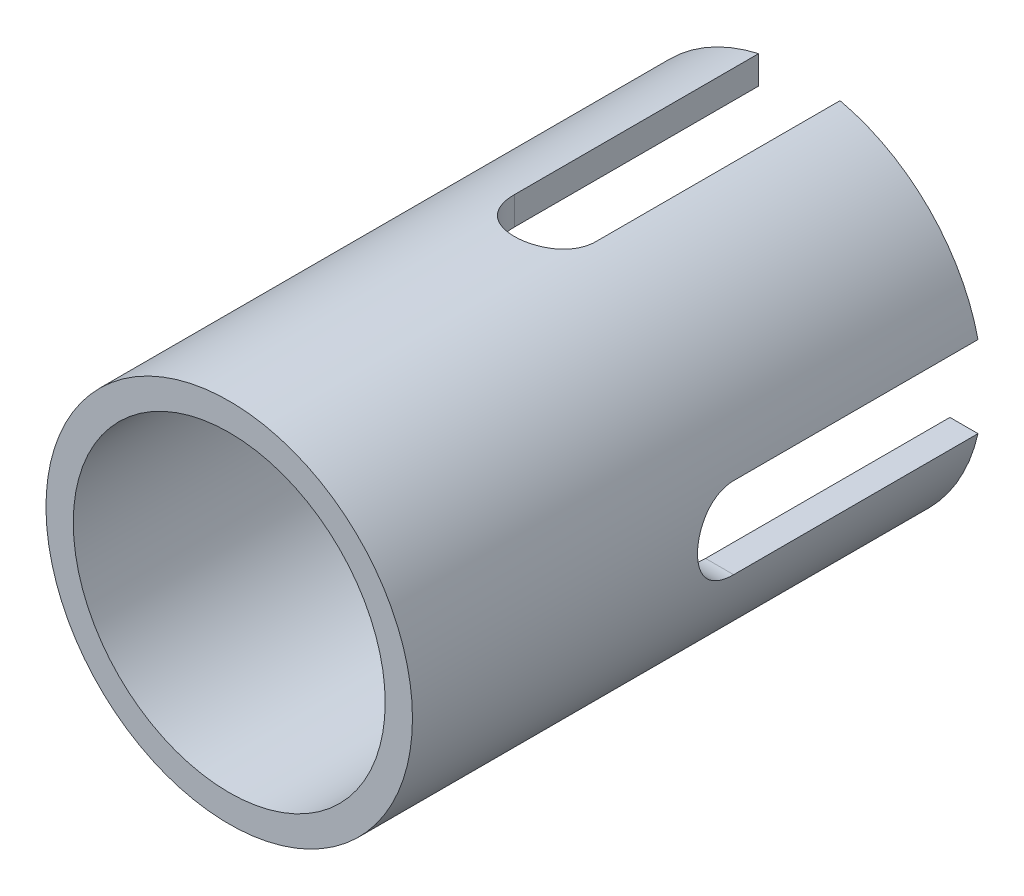
from build123d import *

# Parameters (mm, degrees)
SKETCH12_R          = 57.15
SKETCH12_R_2        = 48.641
BOSS_EXTRUDE1_DEPTH = 177.8
CUT_EXTRUDE1_DEPTH  = 196.30766754
CIRPATTERN1_COUNT   = 2
CIRPATTERN1_ANGLE   = 90


with BuildPart() as part:
    # Sketch12 → Boss-Extrude1 (new body)
    with BuildSketch(Plane.XY):
        Circle(SKETCH12_R)
        Circle(SKETCH12_R_2, mode=Mode.SUBTRACT)
    extrude(amount=BOSS_EXTRUDE1_DEPTH)

    # Sketch13 → Cut-Extrude1 (cut, symmetric)
    with BuildSketch(Plane(origin=(0, 0, 0), x_dir=(1, 0, 0), z_dir=(0, 1, 0))):
        with BuildLine():
            Line((-12.7, 0), (12.7, 0))
            Line((12.7, 0), (12.7, -76.2))
            ThreePointArc((12.7, -76.2), (0, -88.9), (-12.7, -76.2))
            Line((-12.7, -76.2), (-12.7, 0))
        make_face()
    cut_extrude1 = extrude(amount=CUT_EXTRUDE1_DEPTH, both=True, mode=Mode.SUBTRACT)

    # CirPattern1: Cut-Extrude1 ×2 about axis
    cirpattern1_axis = Axis((0, 0, 0), (0, 0, 1))
    for i in range(1, CIRPATTERN1_COUNT):
        add(cut_extrude1.rotate(cirpattern1_axis, i * CIRPATTERN1_ANGLE / (CIRPATTERN1_COUNT - 1)), mode=Mode.SUBTRACT)


solid = part.part
